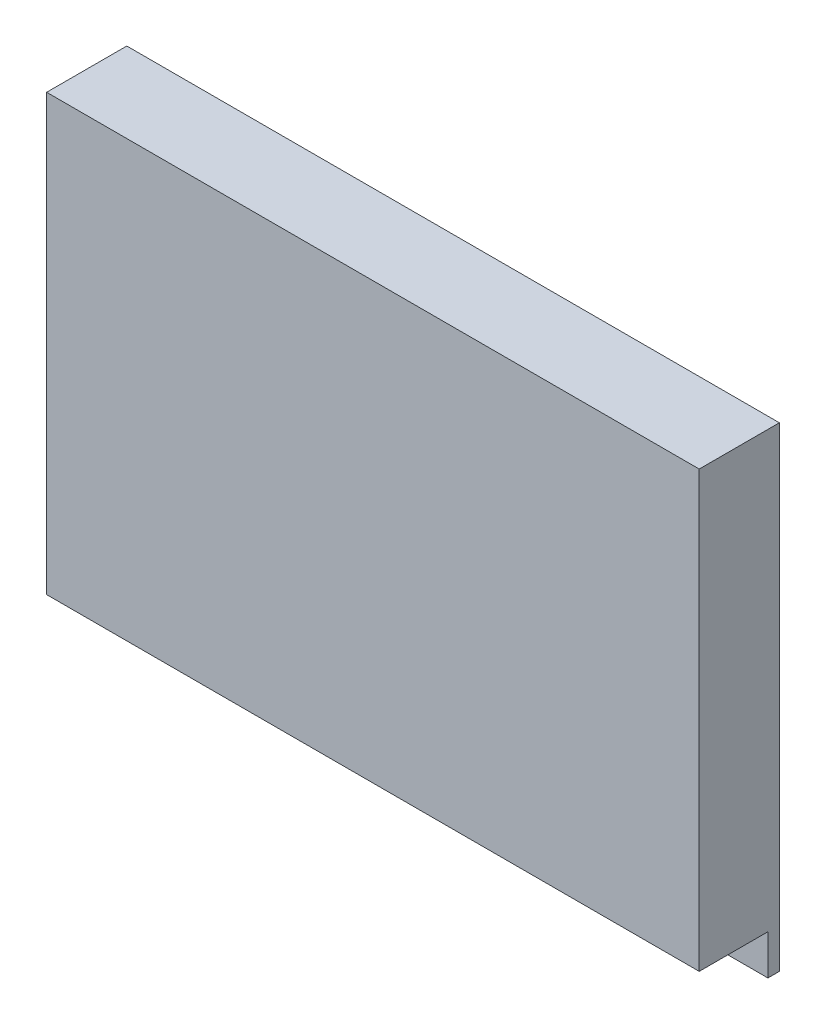
from build123d import *

# Parameters (mm, degrees)
SKETCH1_W             = 57
SKETCH1_H             = 41.5
BOSS_EXTRUDE1_DEPTH   = 1
SKETCH2_W             = 57
SKETCH2_H             = 38
BOSS_EXTRUDE2_DEPTH   = 6
F_1_0MM_DOWEL_HOLE1_D = 1.6


with BuildPart() as part:
    # Sketch1 → Boss-Extrude1 (new body)
    with BuildSketch(Plane.XY):
        with Locations((28.5, 20.75)):
            Rectangle(SKETCH1_W, SKETCH1_H)
    extrude(amount=BOSS_EXTRUDE1_DEPTH)

    # Sketch2 → Boss-Extrude2 (add)
    with BuildSketch(Plane.XY.offset(1)):
        with Locations((28.5, 22.5)):
            Rectangle(SKETCH2_W, SKETCH2_H)
    extrude(amount=BOSS_EXTRUDE2_DEPTH)

    # Ø1.0mm Dowel Hole1 (through all)
    with Locations(Plane(origin=(10, 1.5, 1), x_dir=(1, 0, 0), z_dir=(0, 0, 1))):
        with Locations((0, 0)):
            Hole(F_1_0MM_DOWEL_HOLE1_D / 2)


solid = part.part
